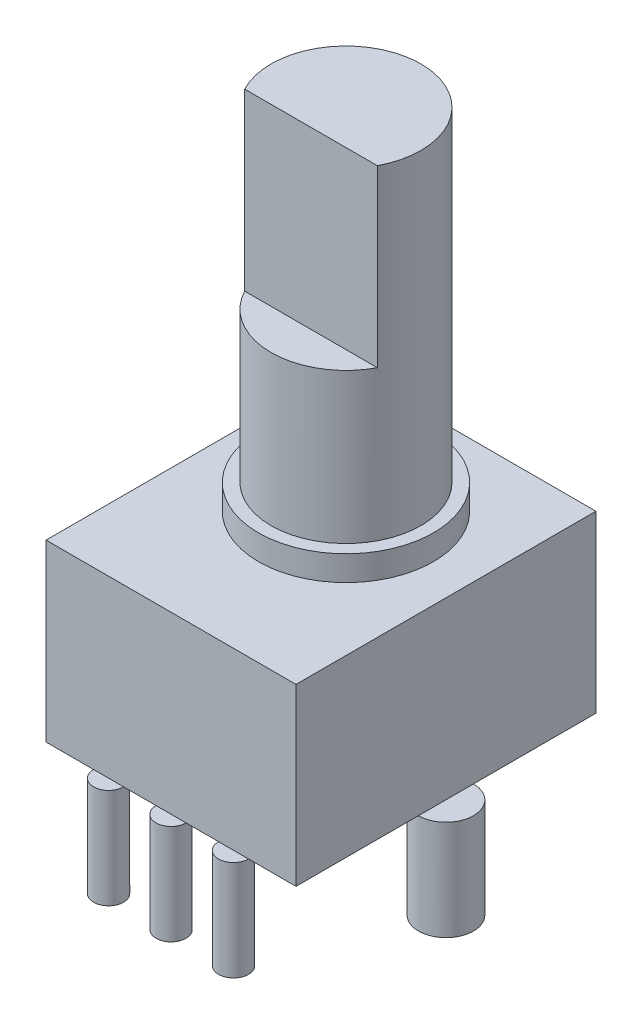
from build123d import *

# Parameters (mm, degrees)
SKETCH1_R           = 3
BOSS_EXTRUDE1_DEPTH = 6
BOSS_EXTRUDE2_DEPTH = 7
SKETCH3_R           = 3.5
BOSS_EXTRUDE3_DEPTH = 1
SKETCH4_W           = 10
SKETCH4_H           = 12
BOSS_EXTRUDE4_DEPTH = 7
SKETCH5_R           = 1.1
BOSS_EXTRUDE5_DEPTH = 4
SKETCH6_R           = 0.6
BOSS_EXTRUDE6_DEPTH = 4


with BuildPart() as part:
    # Sketch1 → Boss-Extrude1 (new body)
    with BuildSketch(Plane(origin=(0, 0, 0), x_dir=(1, 0, 0), z_dir=(0, 1, 0))):
        with Locations(Location((0, 1, 0), (0, 0, 270))):
            Circle(SKETCH1_R)
    extrude(amount=BOSS_EXTRUDE1_DEPTH)

    # Sketch2 → Boss-Extrude2 (add)
    with BuildSketch(Plane(origin=(0, 6, 0), x_dir=(1, 0, 0), z_dir=(0, 1, 0))):
        with BuildLine():
            Line((-2.653299832, -0.4), (2.653299832, -0.4))
            ThreePointArc((2.653299832, -0.4), (0, 4), (-2.653299832, -0.4))
        make_face()
    extrude(amount=BOSS_EXTRUDE2_DEPTH)

    # Sketch3 → Boss-Extrude3 (add)
    with BuildSketch(Plane.XZ):
        with Locations(Location((0, -1, 0), (0, 0, 270))):
            Circle(SKETCH3_R)
    extrude(amount=BOSS_EXTRUDE3_DEPTH)

    # Sketch4 → Boss-Extrude4 (add)
    with BuildSketch(Plane.XZ.offset(1)):
        Rectangle(SKETCH4_W, SKETCH4_H)
    extrude(amount=BOSS_EXTRUDE4_DEPTH)

    # Sketch5 → Boss-Extrude5 (add)
    with BuildSketch(Plane.XZ.offset(8)):
        with Locations(Location((-5.001245267, 0, 0), (0, 0, 89.93513768))):
            Circle(SKETCH5_R)
        with Locations(Location((5, 0, 0), (0, 0, 270))):
            Circle(SKETCH5_R)
    extrude(amount=BOSS_EXTRUDE5_DEPTH)

    # Sketch6 → Boss-Extrude6 (add)
    with BuildSketch(Plane.XZ.offset(8)):
        with Locations(Location((0, 6, 0), (0, 0, 180))):
            Circle(SKETCH6_R)
        with Locations(Location((2.5, 6, 0), (0, 0, 180))):
            Circle(SKETCH6_R)
        with Locations(Location((-2.5, 6, 0), (0, 0, 180))):
            Circle(SKETCH6_R)
    extrude(amount=BOSS_EXTRUDE6_DEPTH)


solid = part.part
